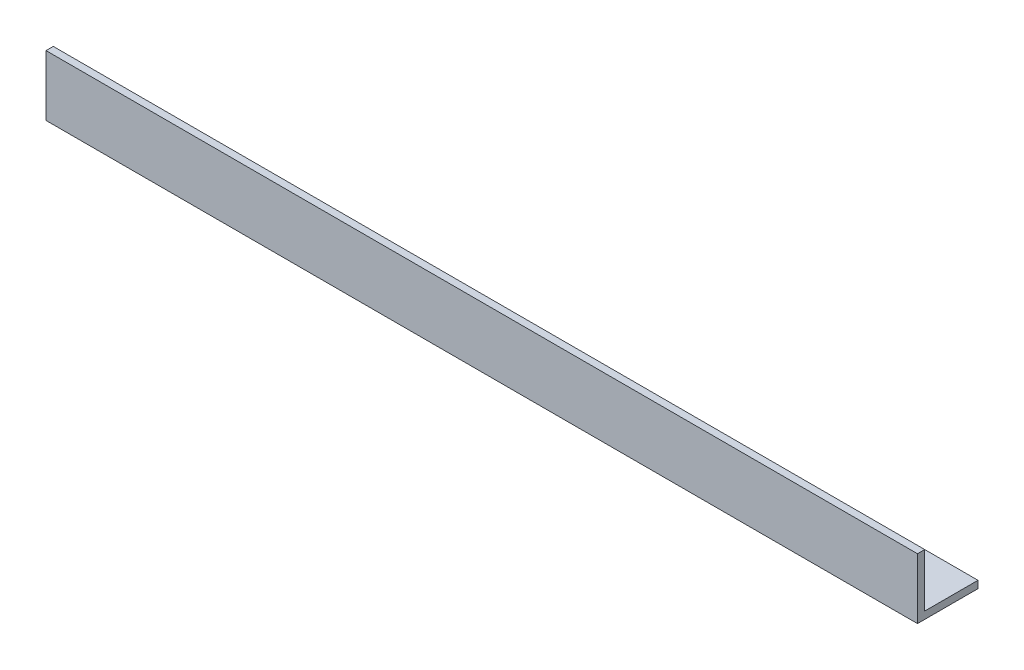
from build123d import *

# Parameters (mm, degrees)
BOSS_EXTRUDE1_DEPTH     = 180
CUT_EXTRUDE1_DEPTH      = 183.66909974
CUT_EXTRUDE1_DEPTH_BACK = 183.66909974
SKETCH2_R               = 2.75


with BuildPart() as part:
    # Sketch1 → Boss-Extrude1 (new, symmetric)
    with BuildSketch(Plane(origin=(0, 0, 0), x_dir=(0, 0, -1), z_dir=(1, 0, 0))):
        Polygon((0, 22), (0, 0), (22, 0), (22, -3), (-3, -3), (-3, 22), align=None)
    extrude(amount=BOSS_EXTRUDE1_DEPTH, both=True)

    # Sketch2 → Cut-Extrude1 (cut, two sides: drawn at the far end of the back side and taken through both)
    with BuildSketch(Plane(origin=(0, 0, 0), x_dir=(1, 0, 0), z_dir=(0, 1, 0)).offset(-CUT_EXTRUDE1_DEPTH_BACK)):
        with Locations(Location((-160, 11, 0), (0, 0, 270))):
            Circle(SKETCH2_R)
        with Locations(Location((-120, 11, 0), (0, 0, 270))):
            Circle(SKETCH2_R)
        with Locations(Location((-80, 11, 0), (0, 0, 270))):
            Circle(SKETCH2_R)
        with Locations(Location((-40, 11, 0), (0, 0, 270))):
            Circle(SKETCH2_R)
        with Locations(Location((0, 11, 0), (0, 0, 270))):
            Circle(SKETCH2_R)
        with Locations(Location((40, 11, 0), (0, 0, 270))):
            Circle(SKETCH2_R)
        with Locations(Location((80, 11, 0), (0, 0, 270))):
            Circle(SKETCH2_R)
        with Locations(Location((120, 11, 0), (0, 0, 270))):
            Circle(SKETCH2_R)
        with Locations(Location((160, 11, 0), (0, 0, 270))):
            Circle(SKETCH2_R)
    extrude(amount=CUT_EXTRUDE1_DEPTH + CUT_EXTRUDE1_DEPTH_BACK, mode=Mode.SUBTRACT)


solid = part.part
